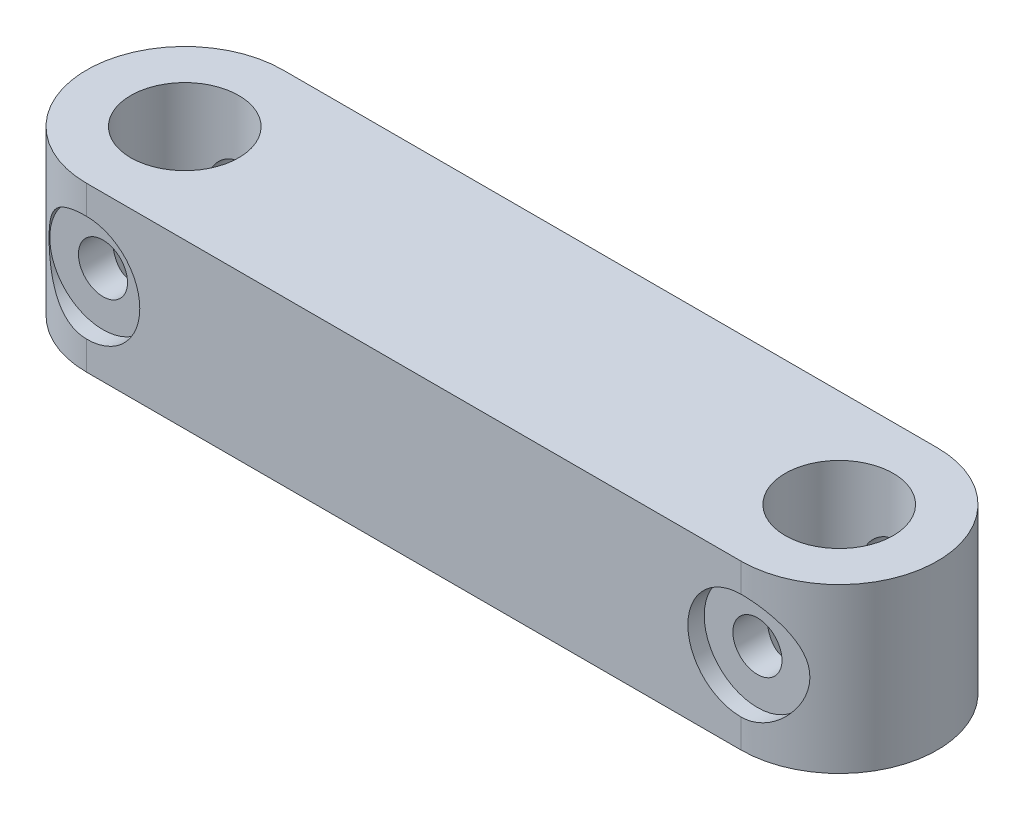
from build123d import *

# Parameters (mm, degrees)
SALIENTE_EXTRUIR1_DEPTH    = 10
CROQUIS2_R                 = 3.3
CORTAR_EXTRUIR1_DEPTH      = 29.495613698
CORTAR_EXTRUIR2_DEPTH      = 29.495613698
CORTAR_EXTRUIR2_DEPTH_BACK = 29.495613698
CROQUIS3_R                 = 1.5
CROQUIS4_R                 = 3.25
CORTAR_EXTRUIR3_DEPTH      = 1


with BuildPart() as part:
    # Croquis1 → Saliente-Extruir1 (new body)
    with BuildSketch(Plane(origin=(0, 0, 0), x_dir=(1, 0, 0), z_dir=(0, 1, 0))):
        with BuildLine():
            Line((-20, 6), (20, 6))
            ThreePointArc((20, 6), (26, 0), (20, -6))
            Line((20, -6), (-20, -6))
            ThreePointArc((-20, -6), (-26, 0), (-20, 6))
        make_face()
    extrude(amount=SALIENTE_EXTRUIR1_DEPTH)

    # Croquis2 → Cortar-Extruir1 (cut, through all)
    with BuildSketch(Plane(origin=(0, 0, 0), x_dir=(1, 0, 0), z_dir=(0, 1, 0))):
        with Locations(Location((-20, 0, 0), (0, 0, 270))):
            Circle(CROQUIS2_R)
        with Locations(Location((20, 0, 0), (0, 0, 270))):
            Circle(CROQUIS2_R)
    extrude(amount=CORTAR_EXTRUIR1_DEPTH, mode=Mode.SUBTRACT)

    # Croquis3 → Cortar-Extruir2 (cut, two sides: drawn at the far end of the back side and taken through both)
    with BuildSketch(Plane.XY.offset(-CORTAR_EXTRUIR2_DEPTH_BACK)):
        with Locations(Location((-20, 5, 0), (0, 0, 89.999999997))):
            Circle(CROQUIS3_R)
        with Locations(Location((20, 5, 0), (0, 0, 89.999999997))):
            Circle(CROQUIS3_R)
    extrude(amount=CORTAR_EXTRUIR2_DEPTH + CORTAR_EXTRUIR2_DEPTH_BACK, mode=Mode.SUBTRACT)

    # Croquis4 → Cortar-Extruir3 (cut)
    with BuildSketch(Plane.XY.offset(6)):
        with Locations((-20, 5)):
            Circle(CROQUIS4_R)
        with Locations(Location((20, 5, 0), (0, 0, 270.000000001))):
            Circle(CROQUIS4_R)
    extrude(amount=-CORTAR_EXTRUIR3_DEPTH, mode=Mode.SUBTRACT)


solid = part.part
